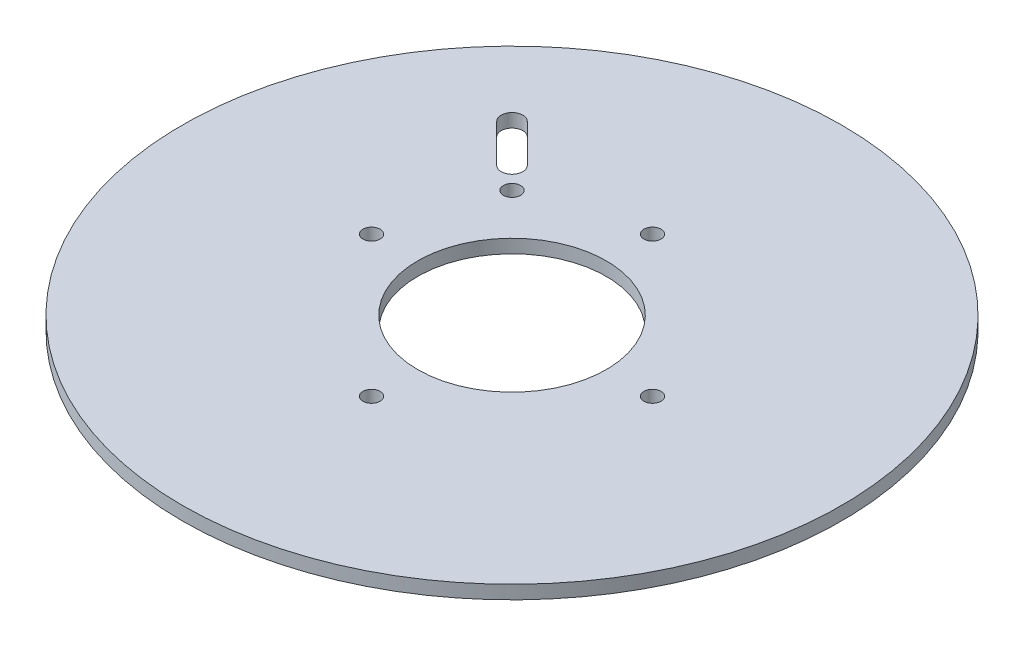
from build123d import *

# Parameters (mm, degrees)
SKETCH1_R           = 77.4600051
BOSS_EXTRUDE1_DEPTH = 3.175
SKETCH24_R          = 22.1615
SKETCH24_R_2        = 2.0193
CUT_EXTRUDE14_DEPTH = 110.590991442


with BuildPart() as part:
    # Sketch1 → Boss-Extrude1 (new body)
    with BuildSketch(Plane(origin=(0, 0, 0), x_dir=(1, 0, 0), z_dir=(0, 1, 0))):
        with Locations(Location((0, 0, 0), (0, 0, 270))):
            Circle(SKETCH1_R)
    extrude(amount=BOSS_EXTRUDE1_DEPTH)

    # Sketch24 → Cut-Extrude14 (cut, through all)
    with BuildSketch(Plane(origin=(0, 3.175, 0), x_dir=(1, 0, 0), z_dir=(0, 1, 0))):
        with Locations(Location((0, 0, 0), (0, 0, 270))):
            Circle(SKETCH24_R)
        with Locations(Location((-25.4, 25.4, 0), (0, 0, 270))):
            Circle(SKETCH24_R_2)
        with Locations(Location((0, 33.02, 0), (0, 0, 270))):
            Circle(SKETCH24_R_2)
        with Locations(Location((33.02, 0, 0), (0, 0, 270))):
            Circle(SKETCH24_R_2)
        with Locations(Location((0, -33.02, 0), (0, 0, 270))):
            Circle(SKETCH24_R_2)
        with Locations(Location((-33.02, 0, 0), (0, 0, 270))):
            Circle(SKETCH24_R_2)
        with BuildLine():
            Line((-32.276051224, 28.683948776), (-41.256307345, 37.664204897))
            ThreePointArc((-41.256307345, 37.664204897), (-41.256307345, 41.256307345), (-37.664204897, 41.256307345))
            Line((-37.664204897, 41.256307345), (-28.683948776, 32.276051224))
            ThreePointArc((-28.683948776, 32.276051224), (-28.683948776, 28.683948776), (-32.276051224, 28.683948776))
        make_face()
    extrude(amount=-CUT_EXTRUDE14_DEPTH, mode=Mode.SUBTRACT)


solid = part.part
